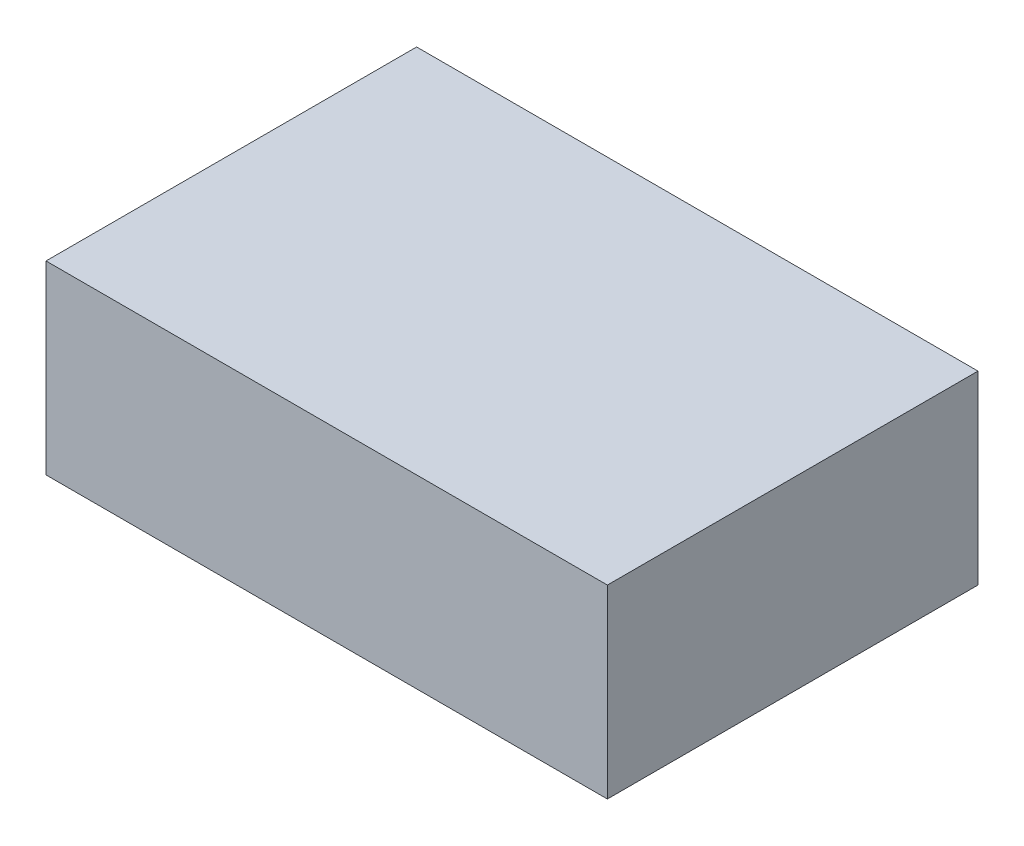
from build123d import *

# Parameters (mm, degrees)
SKETCH1_W           = 261.62
SKETCH1_H           = 172.72
BOSS_EXTRUDE1_DEPTH = 86.36


with BuildPart() as part:
    # Sketch1 → Boss-Extrude1 (new body)
    with BuildSketch(Plane(origin=(0, 0, 0), x_dir=(1, 0, 0), z_dir=(0, 1, 0))):
        with Locations((130.81, 86.36)):
            Rectangle(SKETCH1_W, SKETCH1_H)
    extrude(amount=BOSS_EXTRUDE1_DEPTH)


solid = part.part
